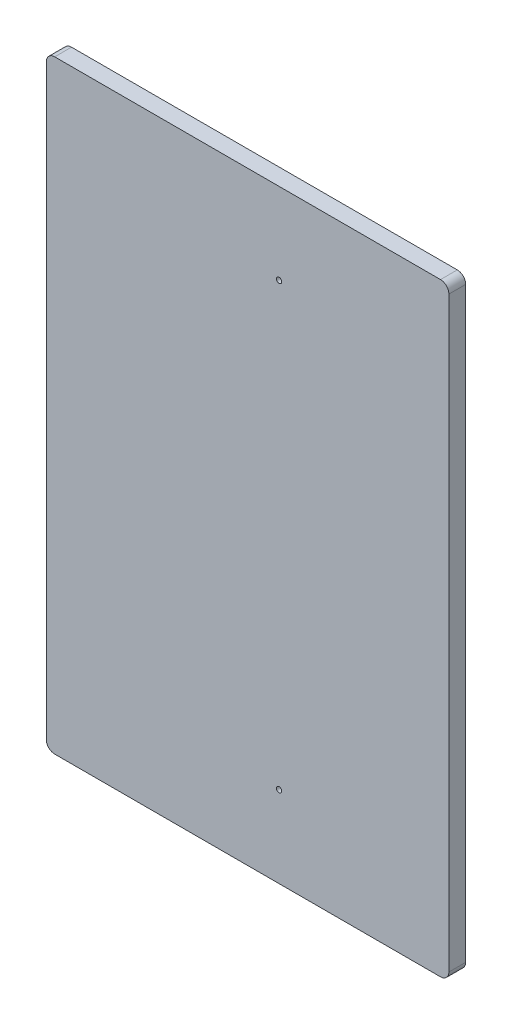
from build123d import *

# Parameters (mm, degrees)
SKETCH2_W              = 304.8
SKETCH2_H              = 457.2
BOSS_EXTRUDE1_DEPTH    = 12.7
FILLET1_R              = 6.35
F_10_32_TAPPED_HOLE1_D = 4.0386


with BuildPart() as part:
    # Sketch2 → Boss-Extrude1 (new body)
    with BuildSketch(Plane.XY):
        Rectangle(SKETCH2_W, SKETCH2_H)
    extrude(amount=BOSS_EXTRUDE1_DEPTH)

    # Fillet1
    fillet1_edges = [part.edges().sort_by_distance(p)[0] for p in [
        (152.4, -228.6, 6.35),
        (-152.4, -228.6, 6.35),
        (-152.4, 228.6, 6.35),
        (152.4, 228.6, 6.35),
    ]]
    fillet(fillet1_edges, radius=FILLET1_R)

    # #10-32 Tapped Hole1 (through all)
    with Locations(Plane(origin=(0, 0, 0), x_dir=(-1, 0, 0), z_dir=(0, 0, -1))):
        with Locations((-23.8125, -167.005), (-23.8125, 167.005)):
            Hole(F_10_32_TAPPED_HOLE1_D / 2)


solid = part.part
